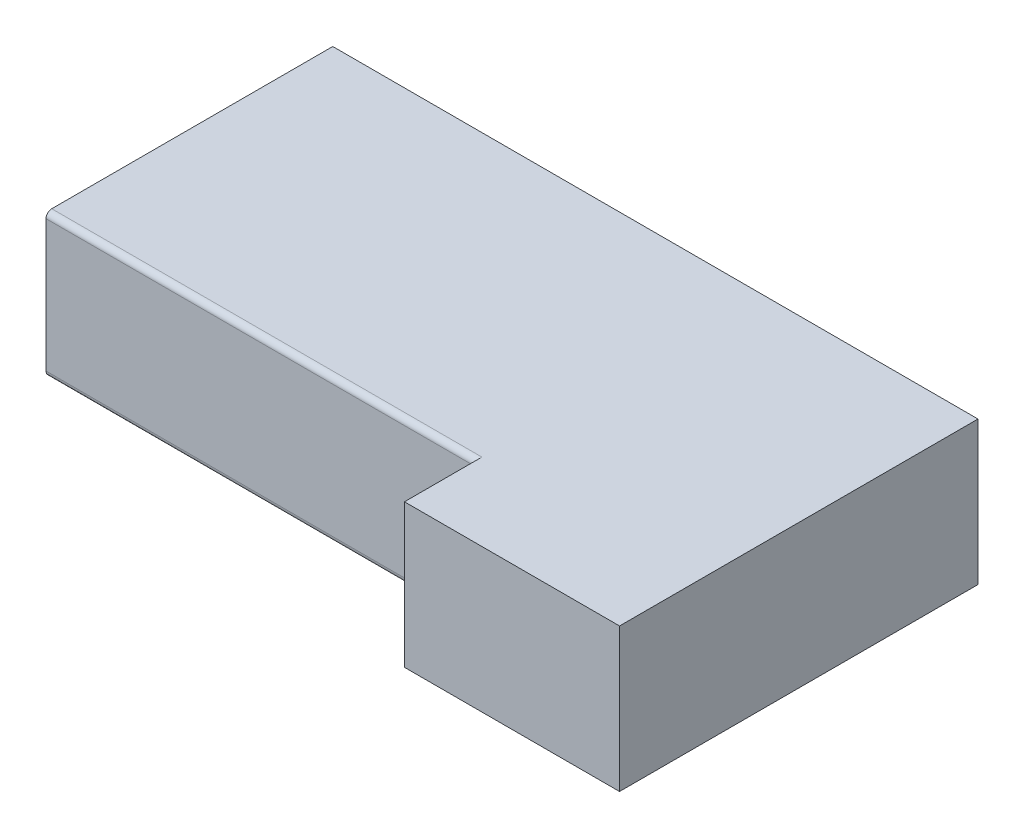
from build123d import *

# Parameters (mm, degrees)
SKETCH1_W           = 57.15
SKETCH1_H           = 25.4
BOSS_EXTRUDE1_DEPTH = 6.35
SKETCH2_W           = 19.05
SKETCH2_H           = 12.7
BOSS_EXTRUDE2_DEPTH = 6.35
FILLET1_R           = 0.508


with BuildPart() as part:
    # Sketch1 → Boss-Extrude1 (new, symmetric)
    with BuildSketch(Plane(origin=(0, 0, 0), x_dir=(1, 0, 0), z_dir=(0, 1, 0))):
        Rectangle(SKETCH1_W, SKETCH1_H)
    extrude(amount=BOSS_EXTRUDE1_DEPTH, both=True)

    # Sketch2 → Boss-Extrude2 (add)
    with BuildSketch(Plane.XY.offset(12.7)):
        with Locations((19.05, 0)):
            Rectangle(SKETCH2_W, SKETCH2_H)
    extrude(amount=BOSS_EXTRUDE2_DEPTH)

    # Fillet1
    fillet1_edges = [part.edges().sort_by_distance(p)[0] for p in [
        (-9.525, 6.35, 12.7),
        (-9.525, -6.35, 12.7),
    ]]
    fillet(fillet1_edges, radius=FILLET1_R)


solid = part.part
